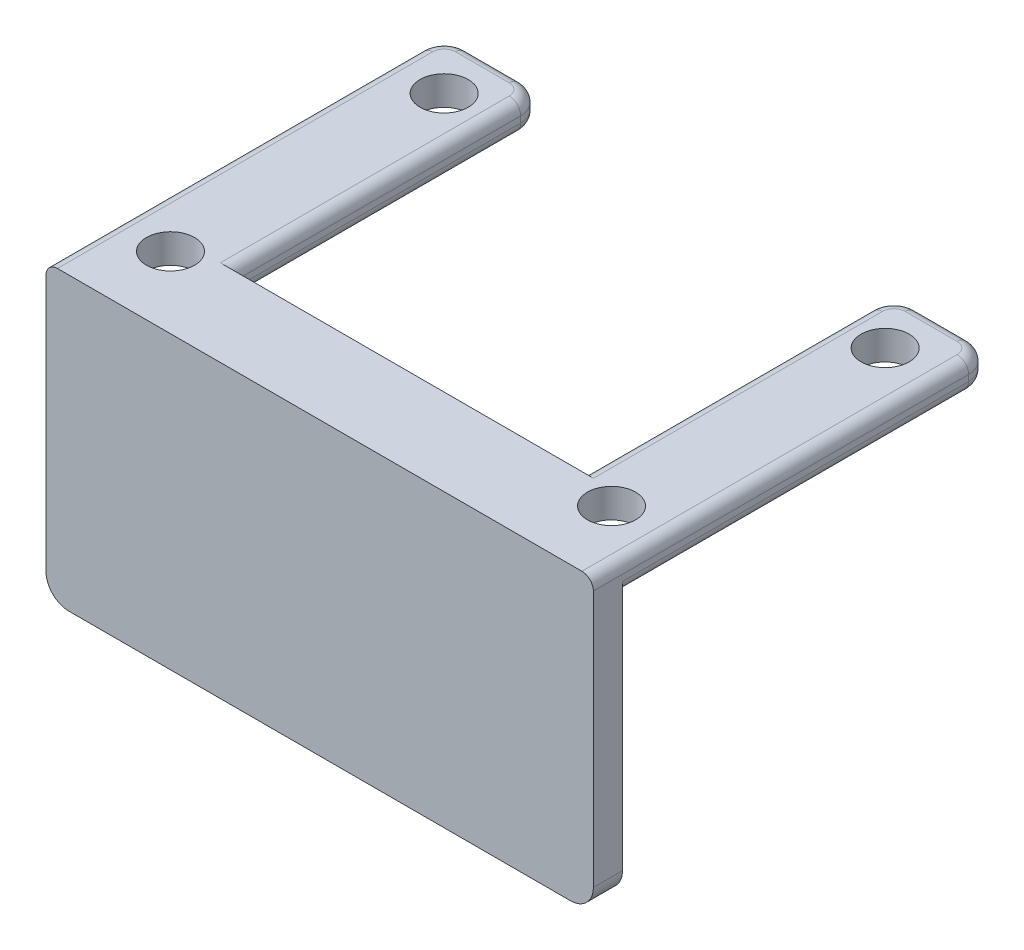
from build123d import *

# Parameters (mm, degrees)
SKETCH1_R           = 2.1
BOSS_EXTRUDE1_DEPTH = 2.54
SKETCH2_W           = 47.761
SKETCH2_H           = 2.54
BOSS_EXTRUDE2_DEPTH = 25.4
FILLET1_R           = 2
FILLET2_R           = 1


with BuildPart() as part:
    # Sketch1 → Boss-Extrude1 (new body)
    with BuildSketch(Plane(origin=(0, 0, 0), x_dir=(1, 0, 0), z_dir=(0, 1, 0))):
        Polygon((-28.418010921, 1.935035563), (2.141991551, 1.935035563), (2.141991551, 29.143665766), (10.663279773, 29.143665766), (10.663279773, -3.055333898), (2.086284412, -3.055333898), (-28.52072334, -3.055333898), (-37.097720227, -3.055333898), (-37.097720227, 29.143665766), (-28.418010921, 29.143665766), align=None)
        with Locations(Location((-32.457720227, 24.503665766, 0), (0, 0, 270))):
            Circle(SKETCH1_R, mode=Mode.SUBTRACT)
        with Locations(Location((-32.457720227, 0.627665766, 0), (0, 0, 270))):
            Circle(SKETCH1_R, mode=Mode.SUBTRACT)
        with Locations(Location((6.023279773, 24.503665766, 0), (0, 0, 270))):
            Circle(SKETCH1_R, mode=Mode.SUBTRACT)
        with Locations(Location((6.023279773, 0.627665766, 0), (0, 0, 270))):
            Circle(SKETCH1_R, mode=Mode.SUBTRACT)
    extrude(amount=BOSS_EXTRUDE1_DEPTH)

    # Sketch2 → Boss-Extrude2 (add)
    with BuildSketch(Plane.XZ.offset(-2.54)):
        with Locations((-13.217220227, 4.325333898)):
            Rectangle(SKETCH2_W, SKETCH2_H)
    extrude(amount=BOSS_EXTRUDE2_DEPTH)

    # Fillet1
    fillet1_edges = [part.edges().sort_by_distance(p)[0] for p in [
        (2.141991551, 1.27, -29.143665766),
        (10.663279773, 1.27, -29.143665766),
        (-37.097720227, 1.27, -29.143665766),
        (-28.418010921, 1.27, -29.143665766),
        (-37.097720227, -22.86, 4.325333898),
        (10.663279773, -22.86, 4.325333898),
    ]]
    fillet(fillet1_edges, radius=FILLET1_R)

    # Fillet2
    fillet2_edges = [part.edges().sort_by_distance(p)[0] for p in [
        (10.663279773, 0, -12.044165934),
        (-28.418010921, 0, -14.539350664),
        (10.663279773, 2.54, -10.774165934),
        (-28.418010921, 2.54, -14.539350664),
        (-32.757865574, 0, -29.143665766),
        (-32.757865574, 2.54, -29.143665766),
        (2.141991551, 0, -14.539350664),
        (6.402635662, 0, -29.143665766),
        (-37.097720227, 0, -12.044165934),
        (10.077493335, 0, -28.557879329),
        (2.727777988, 0, -28.557879329),
        (-36.511933789, 0, -28.557879329),
        (-29.003797359, 0, -28.557879329),
        (-37.097720227, 2.54, -10.774165934),
        (6.402635662, 2.54, -29.143665766),
        (2.141991551, 2.54, -14.539350664),
        (10.077493335, 2.54, -28.557879329),
        (2.727777988, 2.54, -28.557879329),
        (-36.511933789, 2.54, -28.557879329),
        (-29.003797359, 2.54, -28.557879329),
    ]]
    fillet(fillet2_edges, radius=FILLET2_R)


solid = part.part
